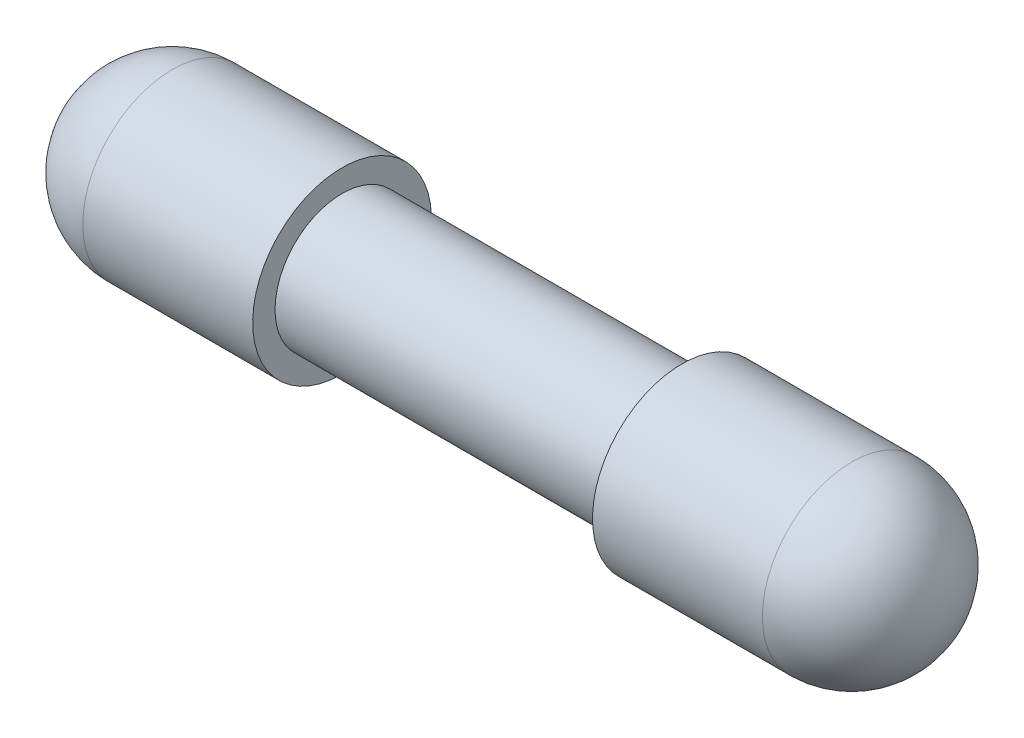
from build123d import *


with BuildPart() as part:
    # Sketch1 → Revolve1 (revolve)
    with BuildSketch(Plane.XY, mode=Mode.PRIVATE) as revolve1_sk:
        with BuildLine():
            Line((-6.639694458, 13.663463824), (-36.802194458, 13.663463824))
            Line((-36.802194458, 13.663463824), (-59.820944458, 13.663463824))
            ThreePointArc((-59.820944458, 13.663463824), (-57.496104533, 19.2761239), (-51.883444458, 21.600963824))
            Line((-51.883444458, 21.600963824), (-36.802194458, 21.600963824))
            Line((-36.802194458, 21.600963824), (-36.802194458, 19.616588824))
            Line((-36.802194458, 19.616588824), (-6.639694458, 19.616588824))
            Line((-6.639694458, 19.616588824), (-6.639694458, 21.600963824))
            Line((-6.639694458, 21.600963824), (8.441555542, 21.600963824))
            ThreePointArc((8.441555542, 21.600963824), (14.054215618, 19.2761239), (16.379055542, 13.663463824))
            Line((16.379055542, 13.663463824), (-6.639694458, 13.663463824))
        make_face()
    revolve(revolve1_sk.sketch.rotate(Axis((-6.639694458, 13.663463824, 0), (1, 0, 0)), 180), axis=Axis((-6.639694458, 13.663463824, 0), (1, 0, 0)))


solid = part.part
